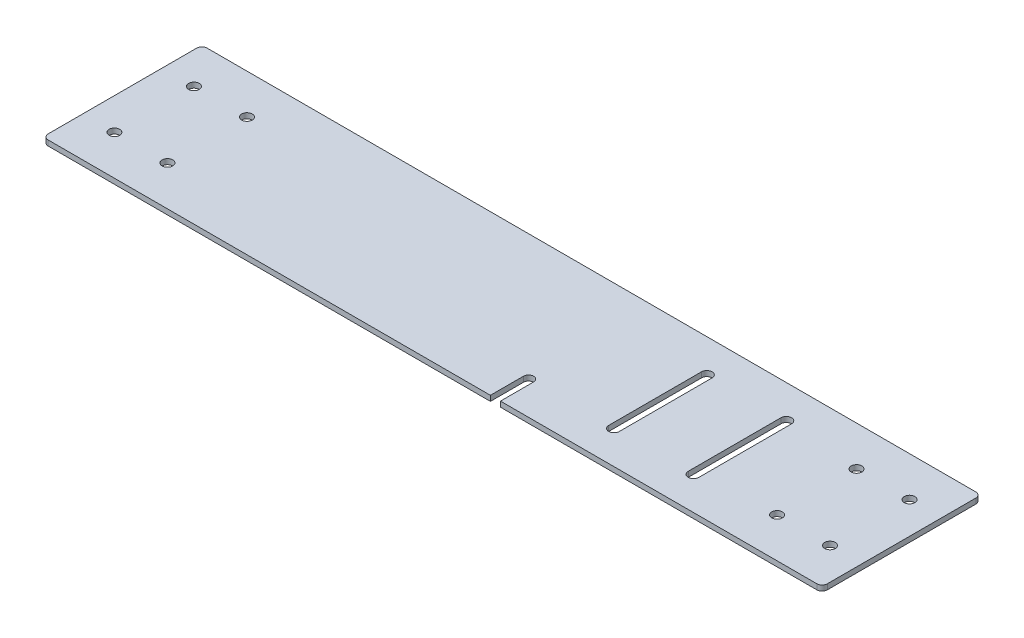
from build123d import *

# Parameters (mm, degrees)
SKETCH1_W           = 47
SKETCH1_H           = 60
SKETCH1_W_2         = 140
SKETCH1_H_2         = 140
BOSS_EXTRUDE1_DEPTH = 2
SKETCH2_R           = 2
CUT_EXTRUDE1_DEPTH  = 10
CUT_EXTRUDE3_DEPTH  = 10
FILLET1_R           = 2
SKETCH12_W          = 218.916263912
SKETCH12_H          = 42.811459275
SKETCH12_H_2        = 41.263513939
CUT_EXTRUDE4_DEPTH  = 10


with BuildPart() as part:
    # Sketch1 → Boss-Extrude1 (new body)
    with BuildSketch(Plane(origin=(0, 0, 0), x_dir=(1, 0, 0), z_dir=(0, 1, 0))):
        with Locations((-123.5, 0)):
            Rectangle(SKETCH1_W, SKETCH1_H)
        Polygon((-100, 30), (-100, -30), (-70, -70), (-70, 70), align=None)
        Rectangle(SKETCH1_W_2, SKETCH1_H_2)
        Polygon((100, 30), (100, -30), (70, -70), (70, 70), align=None)
        with Locations((123.5, 0)):
            Rectangle(SKETCH1_W, SKETCH1_H)
    extrude(amount=BOSS_EXTRUDE1_DEPTH)

    # Sketch2 → Cut-Extrude1 (cut)
    with BuildSketch(Plane(origin=(0, 2, 0), x_dir=(1, 0, 0), z_dir=(0, 1, 0))):
        with Locations(Location((-135, 15, 0), (0, 0, 270))):
            Circle(SKETCH2_R)
        with Locations(Location((-115, 15, 0), (0, 0, 270))):
            Circle(SKETCH2_R)
        with Locations(Location((-135, -15, 0), (0, 0, 270))):
            Circle(SKETCH2_R)
        with Locations(Location((-115, -15, 0), (0, 0, 270))):
            Circle(SKETCH2_R)
    cut_extrude1 = extrude(amount=-CUT_EXTRUDE1_DEPTH, mode=Mode.SUBTRACT)

    # Mirror1: Cut-Extrude1 across plane
    add(cut_extrude1.mirror(Plane(origin=(0, 0, 0), x_dir=(0, 0, 1), z_dir=(1, 0, 0))), mode=Mode.SUBTRACT)

    # Sketch11 → Cut-Extrude3 (cut)
    with BuildSketch(Plane(origin=(0, 2, 0), x_dir=(1, 0, 0), z_dir=(0, 1, 0))):
        with BuildLine():
            Line((58, -17.5), (58, 17.5))
            ThreePointArc((58, 17.5), (56, 19.5), (54, 17.5))
            Line((54, 17.5), (54, -17.5))
            ThreePointArc((54, -17.5), (56, -19.5), (58, -17.5))
        make_face()
        with BuildLine():
            Line((84, -17.5), (84, 17.5))
            ThreePointArc((84, 17.5), (86, 19.5), (88, 17.5))
            Line((88, 17.5), (88, -17.5))
            ThreePointArc((88, -17.5), (86, -19.5), (84, -17.5))
        make_face()
        with BuildLine():
            Line((21.85, -17.5), (21.85, -47.5))
            ThreePointArc((21.85, -47.5), (23.75, -49.4), (25.65, -47.5))
            Line((25.65, -47.5), (25.65, -17.5))
            ThreePointArc((25.65, -17.5), (23.75, -15.6), (21.85, -17.5))
        make_face()
    extrude(amount=-CUT_EXTRUDE3_DEPTH, mode=Mode.SUBTRACT)

    # Fillet1
    fillet1_edges = [part.edges().sort_by_distance(p)[0] for p in [
        (-147, 1, 30),
        (-147, 1, -30),
        (-100, 1, -30),
        (-70, 1, -70),
        (70, 1, -70),
        (100, 1, -30),
        (147, 1, -30),
        (147, 1, 30),
        (100, 1, 30),
        (70, 1, 70),
        (-70, 1, 70),
        (-100, 1, 30),
    ]]
    fillet(fillet1_edges, radius=FILLET1_R)

    # Sketch12 → Cut-Extrude4 (cut)
    with BuildSketch(Plane(origin=(0, 2, 0), x_dir=(1, 0, 0), z_dir=(0, 1, 0))):
        with Locations((-2.238018123, 51.405729638)):
            Rectangle(SKETCH12_W, SKETCH12_H)
        with Locations((-2.238018123, -50.63175697)):
            Rectangle(SKETCH12_W, SKETCH12_H_2)
    extrude(amount=-CUT_EXTRUDE4_DEPTH, mode=Mode.SUBTRACT)


solid = part.part
